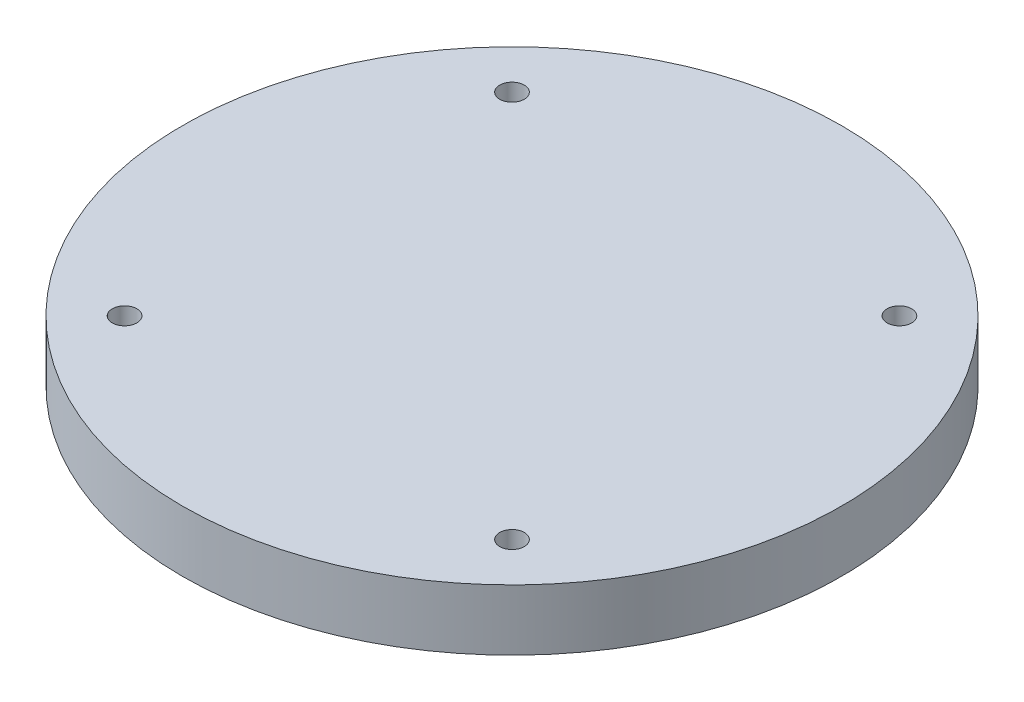
from build123d import *

# Parameters (mm, degrees)
SKETCH1_R           = 27.5
BOSS_EXTRUDE1_DEPTH = 5.08
SKETCH2_R           = 1.025
CUT_EXTRUDE1_DEPTH  = 3.175


with BuildPart() as part:
    # Sketch1 → Boss-Extrude1 (new body)
    with BuildSketch(Plane(origin=(0, 0, 0), x_dir=(1, 0, 0), z_dir=(0, 1, 0))):
        with Locations(Location((0, 0, 0), (0, 0, 270))):
            Circle(SKETCH1_R)
    extrude(amount=BOSS_EXTRUDE1_DEPTH)

    # Sketch2 → Cut-Extrude1 (cut)
    with BuildSketch(Plane(origin=(0, 5.08, 0), x_dir=(1, 0, 0), z_dir=(0, 1, 0))):
        with Locations(Location((16.164461018, 16.164461018, 0), (0, 0, 270))):
            Circle(SKETCH2_R)
        with Locations(Location((16.164461018, -16.164461018, 0), (0, 0, 270))):
            Circle(SKETCH2_R)
        with Locations(Location((-16.164461018, -16.164461018, 0), (0, 0, 270))):
            Circle(SKETCH2_R)
        with Locations(Location((-16.164461018, 16.164461018, 0), (0, 0, 270))):
            Circle(SKETCH2_R)
    extrude(amount=-CUT_EXTRUDE1_DEPTH, mode=Mode.SUBTRACT)


solid = part.part
